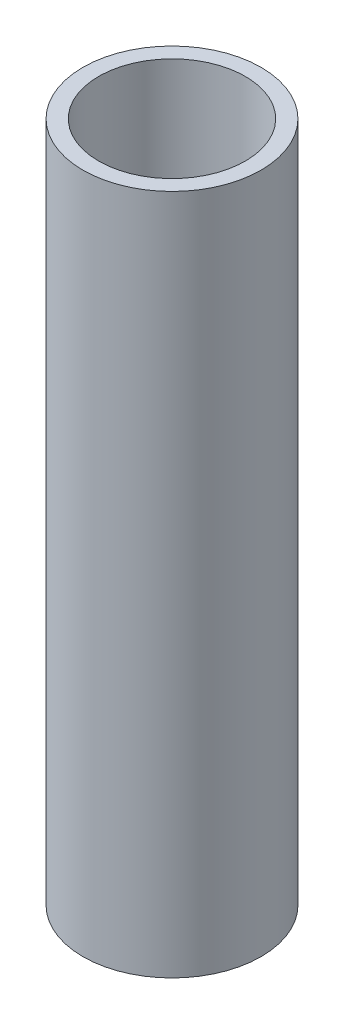
from build123d import *

# Parameters (mm, degrees)
SKETCH1_R           = 17
SKETCH1_R_2         = 14
BOSS_EXTRUDE1_DEPTH = 130


with BuildPart() as part:
    # Sketch1 → Boss-Extrude1 (new body)
    with BuildSketch(Plane(origin=(0, 0, 0), x_dir=(1, 0, 0), z_dir=(0, 1, 0))):
        with Locations(Location((0, 0, 0), (0, 0, 270))):
            Circle(SKETCH1_R)
        with Locations(Location((0, 0, 0), (0, 0, 270))):
            Circle(SKETCH1_R_2, mode=Mode.SUBTRACT)
    extrude(amount=BOSS_EXTRUDE1_DEPTH)


solid = part.part
